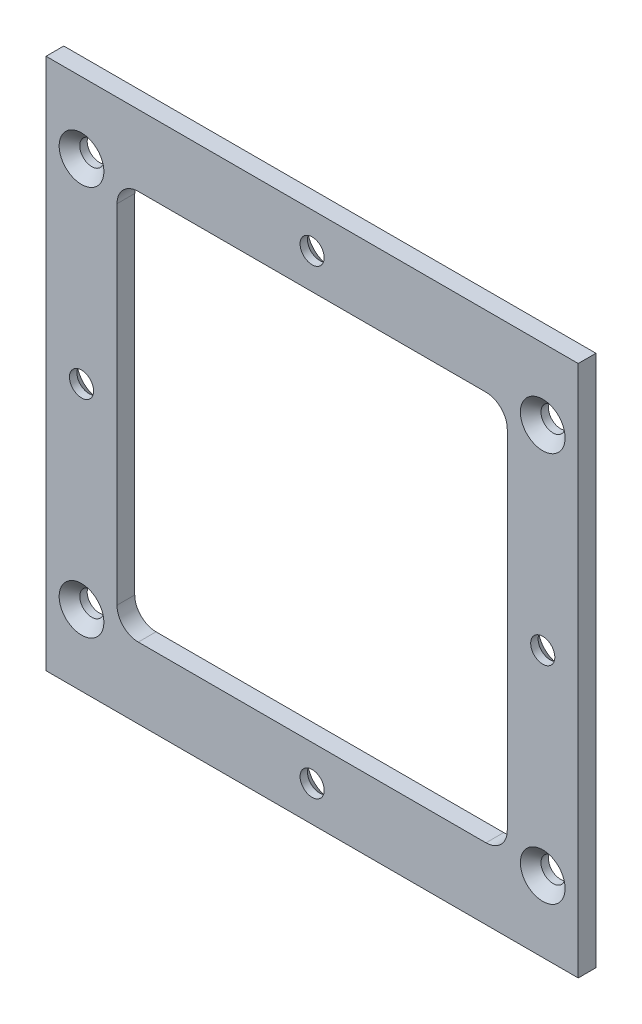
from build123d import *

# Parameters (mm, degrees)
SKETCH1_W                                      = 75
SKETCH1_H                                      = 75
BOSS_EXTRUDE1_DEPTH                            = 2.5
CSK_FOR_M3_OVAL_HEAD_MACHINE_SCREW1_AT_2_COUNT = 2
CSK_FOR_M3_OVAL_HEAD_MACHINE_SCREW1_AT_2_PITCH = 65
CSK_FOR_M3_OVAL_HEAD_MACHINE_SCREW1_AT_3_COUNT = 2
CSK_FOR_M3_OVAL_HEAD_MACHINE_SCREW1_AT_3_PITCH = 85.14693183
CSK_FOR_M3_OVAL_HEAD_MACHINE_SCREW1_AT_4_COUNT = 2
CSK_FOR_M3_OVAL_HEAD_MACHINE_SCREW1_AT_4_PITCH = 55
CSK_FOR_M3_OVAL_HEAD_MACHINE_SCREW2_AT_2_COUNT = 2
CSK_FOR_M3_OVAL_HEAD_MACHINE_SCREW2_AT_2_PITCH = 45.961940777
CSK_FOR_M3_OVAL_HEAD_MACHINE_SCREW2_AT_3_COUNT = 2
CSK_FOR_M3_OVAL_HEAD_MACHINE_SCREW2_AT_3_PITCH = 45.961940777
CSK_FOR_M3_OVAL_HEAD_MACHINE_SCREW2_AT_4_COUNT = 2
CSK_FOR_M3_OVAL_HEAD_MACHINE_SCREW2_AT_4_PITCH = 65


with BuildPart() as part:
    # Sketch1 → Boss-Extrude1 (new body)
    with BuildSketch(Plane.XY):
        with Locations((0, 37.5)):
            Rectangle(SKETCH1_W, SKETCH1_H)
        with BuildLine():
            Line((-24.5, 10), (24.5, 10))
            ThreePointArc((24.5, 10), (26.621320344, 10.878679656), (27.5, 13))
            Line((27.5, 13), (27.5, 62))
            ThreePointArc((27.5, 62), (26.621320344, 64.121320344), (24.5, 65))
            Line((24.5, 65), (-24.5, 65))
            ThreePointArc((-24.5, 65), (-26.621320344, 64.121320344), (-27.5, 62))
            Line((-27.5, 62), (-27.5, 13))
            ThreePointArc((-27.5, 13), (-26.621320344, 10.878679656), (-24.5, 10))
        make_face(mode=Mode.SUBTRACT)
    extrude(amount=BOSS_EXTRUDE1_DEPTH)

    # Sketch2 → CSK for M3 Oval Head Machine Screw1 (revolve, cut)
    with BuildSketch(Plane(origin=(32.5, 10, 2.5), x_dir=(0, -1, 0), z_dir=(1, 0, 0))):
        Polygon((0, 0), (0, 2.5), (1.7, 2.5), (1.7, 1.45), (3.15, 0), align=None)
    csk_for_m3_oval_head_machine_screw1 = revolve(axis=Axis((32.5, 10, 8.85), (0, 0, -1)), mode=Mode.SUBTRACT)

    # CSK for M3 Oval Head Machine Screw1 at 2: CSK for M3 Oval Head Machine Screw1 ×2
    with Locations(*[(-i * CSK_FOR_M3_OVAL_HEAD_MACHINE_SCREW1_AT_2_PITCH, 0, 0) for i in range(1, CSK_FOR_M3_OVAL_HEAD_MACHINE_SCREW1_AT_2_COUNT)]):
        add(csk_for_m3_oval_head_machine_screw1, mode=Mode.SUBTRACT)

    # CSK for M3 Oval Head Machine Screw1 at 3: CSK for M3 Oval Head Machine Screw1 ×2
    with Locations(*[Vector(-0.7633862853691147, 0.6459422414661737, 0) * (i * CSK_FOR_M3_OVAL_HEAD_MACHINE_SCREW1_AT_3_PITCH) for i in range(1, CSK_FOR_M3_OVAL_HEAD_MACHINE_SCREW1_AT_3_COUNT)]):
        add(csk_for_m3_oval_head_machine_screw1, mode=Mode.SUBTRACT)

    # CSK for M3 Oval Head Machine Screw1 at 4: CSK for M3 Oval Head Machine Screw1 ×2
    with Locations(*[(0, i * CSK_FOR_M3_OVAL_HEAD_MACHINE_SCREW1_AT_4_PITCH, 0) for i in range(1, CSK_FOR_M3_OVAL_HEAD_MACHINE_SCREW1_AT_4_COUNT)]):
        add(csk_for_m3_oval_head_machine_screw1, mode=Mode.SUBTRACT)

    # Sketch3 → CSK for M3 Oval Head Machine Screw2 (revolve, cut)
    with BuildSketch(Plane(origin=(0, 5, 0), x_dir=(0, 1, 0), z_dir=(1, 0, 0))):
        Polygon((0, 0), (0, 2.5), (1.7, 2.5), (1.7, 1.45), (3.15, 0), align=None)
    csk_for_m3_oval_head_machine_screw2 = revolve(axis=Axis((0, 5, -6.35), (0, 0, 1)), mode=Mode.SUBTRACT)

    # CSK for M3 Oval Head Machine Screw2 at 2: CSK for M3 Oval Head Machine Screw2 ×2
    with Locations(*[Vector(-0.7071067811865476, 0.7071067811865476, 0) * (i * CSK_FOR_M3_OVAL_HEAD_MACHINE_SCREW2_AT_2_PITCH) for i in range(1, CSK_FOR_M3_OVAL_HEAD_MACHINE_SCREW2_AT_2_COUNT)]):
        add(csk_for_m3_oval_head_machine_screw2, mode=Mode.SUBTRACT)

    # CSK for M3 Oval Head Machine Screw2 at 3: CSK for M3 Oval Head Machine Screw2 ×2
    with Locations(*[Vector(0.7071067811865475, 0.7071067811865476, 0) * (i * CSK_FOR_M3_OVAL_HEAD_MACHINE_SCREW2_AT_3_PITCH) for i in range(1, CSK_FOR_M3_OVAL_HEAD_MACHINE_SCREW2_AT_3_COUNT)]):
        add(csk_for_m3_oval_head_machine_screw2, mode=Mode.SUBTRACT)

    # CSK for M3 Oval Head Machine Screw2 at 4: CSK for M3 Oval Head Machine Screw2 ×2
    with Locations(*[(0, i * CSK_FOR_M3_OVAL_HEAD_MACHINE_SCREW2_AT_4_PITCH, 0) for i in range(1, CSK_FOR_M3_OVAL_HEAD_MACHINE_SCREW2_AT_4_COUNT)]):
        add(csk_for_m3_oval_head_machine_screw2, mode=Mode.SUBTRACT)


solid = part.part
